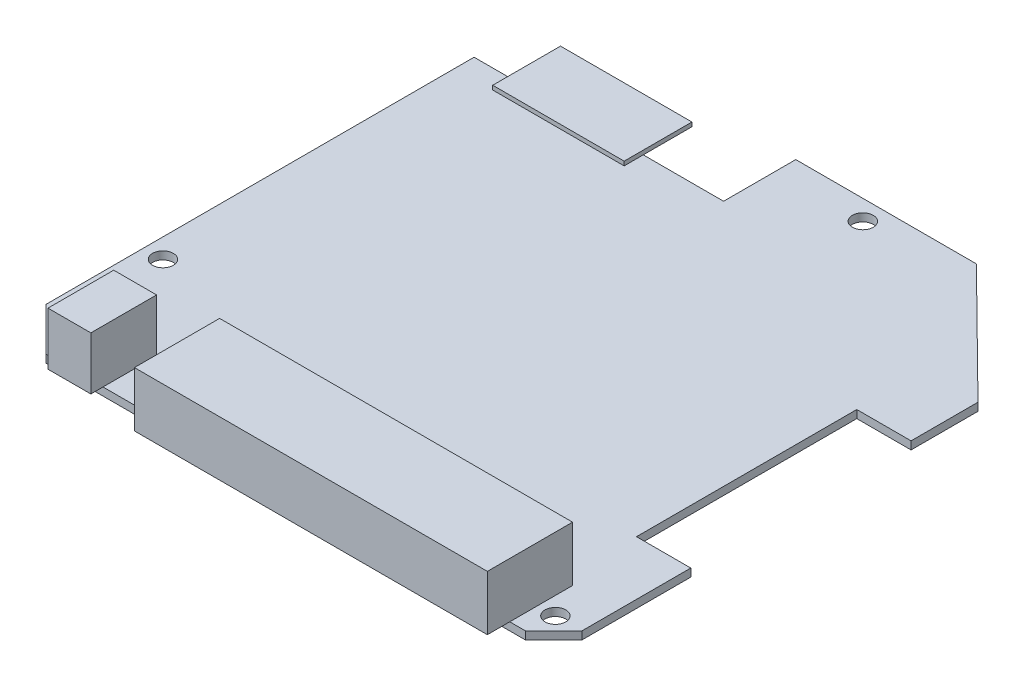
from build123d import *

# Parameters (mm, degrees)
PCB_DEPTH        = 1.651
SKETCH2_R        = 2.1717
MOUNTHOLES_DEPTH = 81.742262348
SKETCH3_W        = 73.66
SKETCH3_H        = 17.78
RJ45_DEPTH       = 11.4554
SKETCH4_W        = 27.432
SKETCH4_H        = 14.1478
ANT_DEPTH        = 0.8636
SKETCH6_W        = 8.9408
SKETCH6_H        = 13.716
POWER_DEPTH      = 11.049


with BuildPart() as part:
    # Sketch1 → PCB (new body)
    with BuildSketch(Plane(origin=(0, 0, 0), x_dir=(1, 0, 0), z_dir=(0, 1, 0))):
        Polygon((-57.4675, 41.6306), (-57.4675, -47.712543879), (-48.487243879, -56.6928), (51.54053096, -56.6928), (57.4675, -50.76583096), (57.4675, -28.08363096), (46.1391, -28.08363096), (46.1391, 17.89036904), (57.4675, 17.89036904), (57.4675, 31.86036904), (32.2961, 56.6928), (-5.3975, 56.6928), (-5.3975, 41.6306), align=None)
    extrude(amount=PCB_DEPTH)

    # Sketch2 → MountHoles (cut, through all)
    with BuildSketch(Plane(origin=(0, 1.651, 0), x_dir=(1, 0, 0), z_dir=(0, 1, 0))):
        with Locations(Location((-53.4035, -27.3685, 0), (0, 0, 270))):
            Circle(SKETCH2_R)
        with Locations(Location((12.7508, 52.5399, 0), (0, 0, 270))):
            Circle(SKETCH2_R)
        with Locations(Location((51.9938, -50.8635, 0), (0, 0, 270))):
            Circle(SKETCH2_R)
    extrude(amount=-MOUNTHOLES_DEPTH, mode=Mode.SUBTRACT)


with BuildPart() as body_2:
    # Sketch3 → RJ45 (new body)
    with BuildSketch(Plane(origin=(0, 1.651, 0), x_dir=(1, 0, 0), z_dir=(0, 1, 0))):
        with Locations((11.4681, -52.4764)):
            Rectangle(SKETCH3_W, SKETCH3_H)
    extrude(amount=RJ45_DEPTH)


with BuildPart() as body_3:
    # Sketch4 → Ant (new body)
    with BuildSketch(Plane(origin=(0, 1.651, 0), x_dir=(1, 0, 0), z_dir=(0, 1, 0))):
        with Locations((-35.8775, 44.7167)):
            Rectangle(SKETCH4_W, SKETCH4_H)
    extrude(amount=ANT_DEPTH)


with BuildPart() as body_4:
    # Sketch6 → Power (new body)
    with BuildSketch(Plane(origin=(0, 1.651, 0), x_dir=(1, 0, 0), z_dir=(0, 1, 0))):
        with Locations((-41.0591, -52.3748)):
            Rectangle(SKETCH6_W, SKETCH6_H)
    extrude(amount=POWER_DEPTH)


solid = Compound([part.part, body_2.part, body_3.part, body_4.part])
